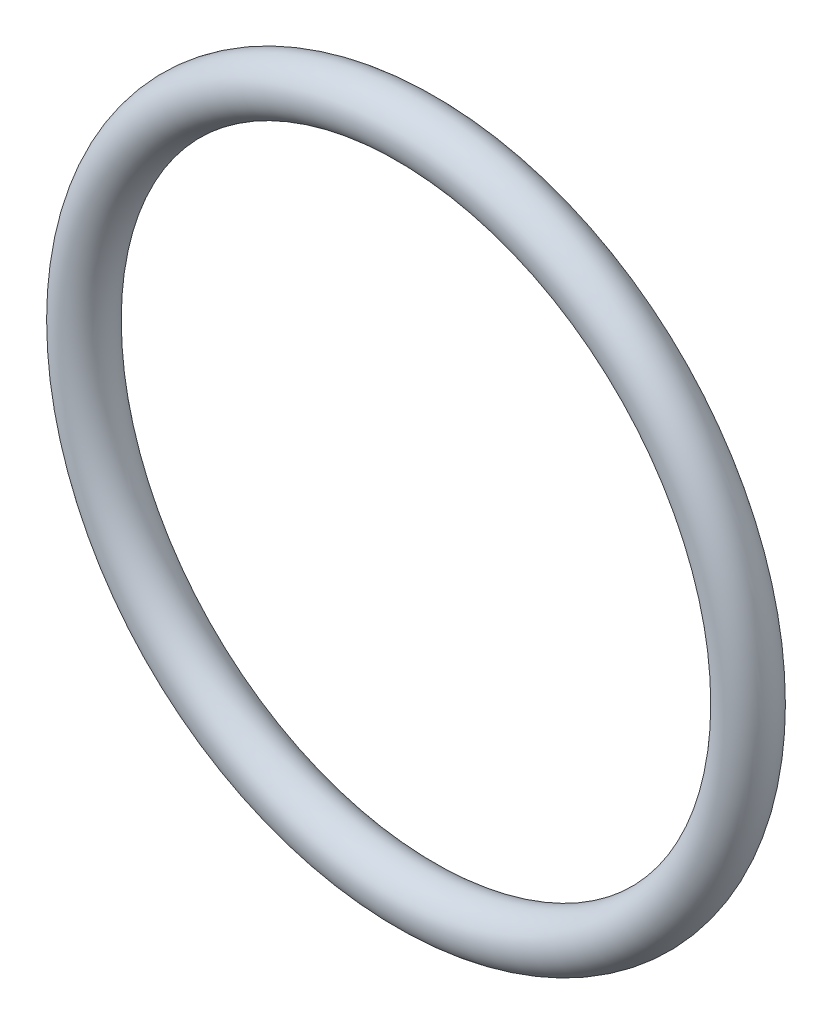
from build123d import *

# Parameters (mm, degrees)
SKETCH1_R = 1.7653


with BuildPart() as part:
    # Sketch1 → Revolve1 (revolve)
    with BuildSketch(Plane(origin=(0, 0, 0), x_dir=(0, -1, 0), z_dir=(1, 0, 0)), mode=Mode.PRIVATE) as revolve1_sk:
        with Locations((22.1996, 0)):
            Circle(SKETCH1_R)
    revolve(revolve1_sk.sketch.rotate(Axis((0, 0, 1.7653), (0, 0, -1)), 270), axis=Axis((0, 0, 1.7653), (0, 0, -1)))


solid = part.part
